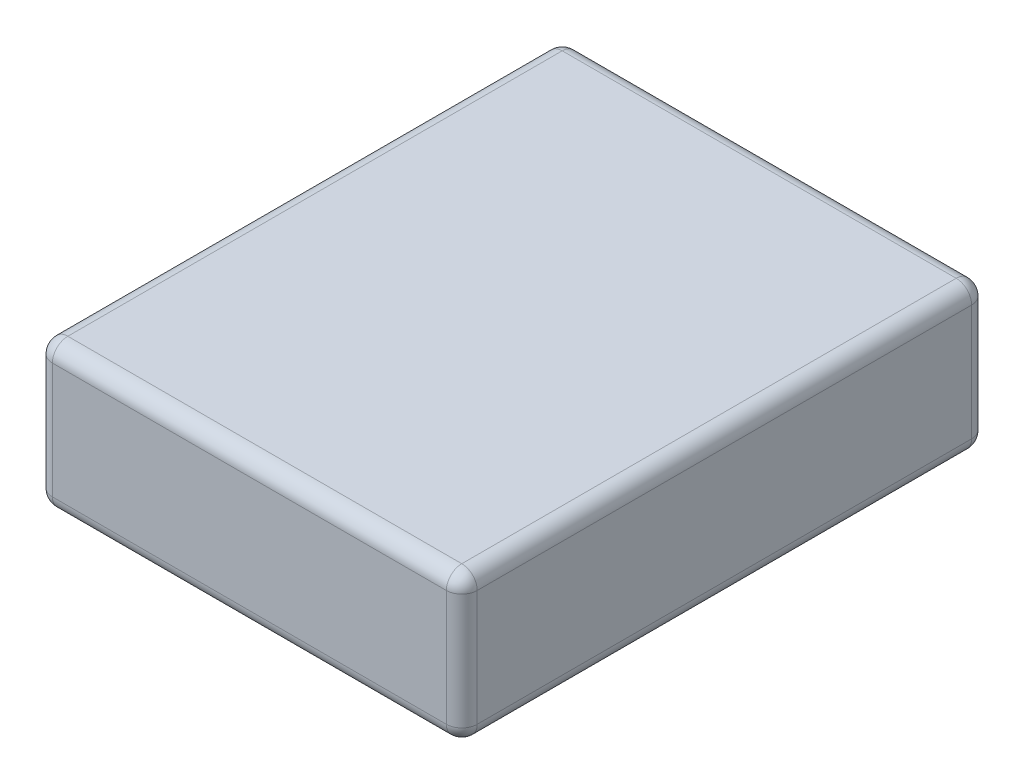
from build123d import *

# Parameters (mm, degrees)
SKETCH_1_W      = 55
SKETCH_1_H      = 68
EXTRUDE_1_DEPTH = 19
FILLET_1_R      = 2


with BuildPart() as part:
    # 草图1 → 凸台-拉伸1 (new body)
    with BuildSketch(Plane(origin=(0, 0, 0), x_dir=(1, 0, 0), z_dir=(0, 1, 0))):
        Rectangle(SKETCH_1_W, SKETCH_1_H)
    extrude(amount=EXTRUDE_1_DEPTH)

    # 圆角1
    fillet_1_edges = [part.edges().sort_by_distance(p)[0] for p in [
        (27.5, 19, 0),
        (0, 19, -34),
        (-27.5, 19, 0),
        (0, 0, -34),
        (27.5, 0, 0),
        (0, 0, 34),
        (-27.5, 0, 0),
        (-27.5, 9.5, -34),
        (27.5, 9.5, -34),
        (27.5, 9.5, 34),
        (-27.5, 9.5, 34),
        (0, 19, 34),
    ]]
    fillet(fillet_1_edges, radius=FILLET_1_R)


solid = part.part
